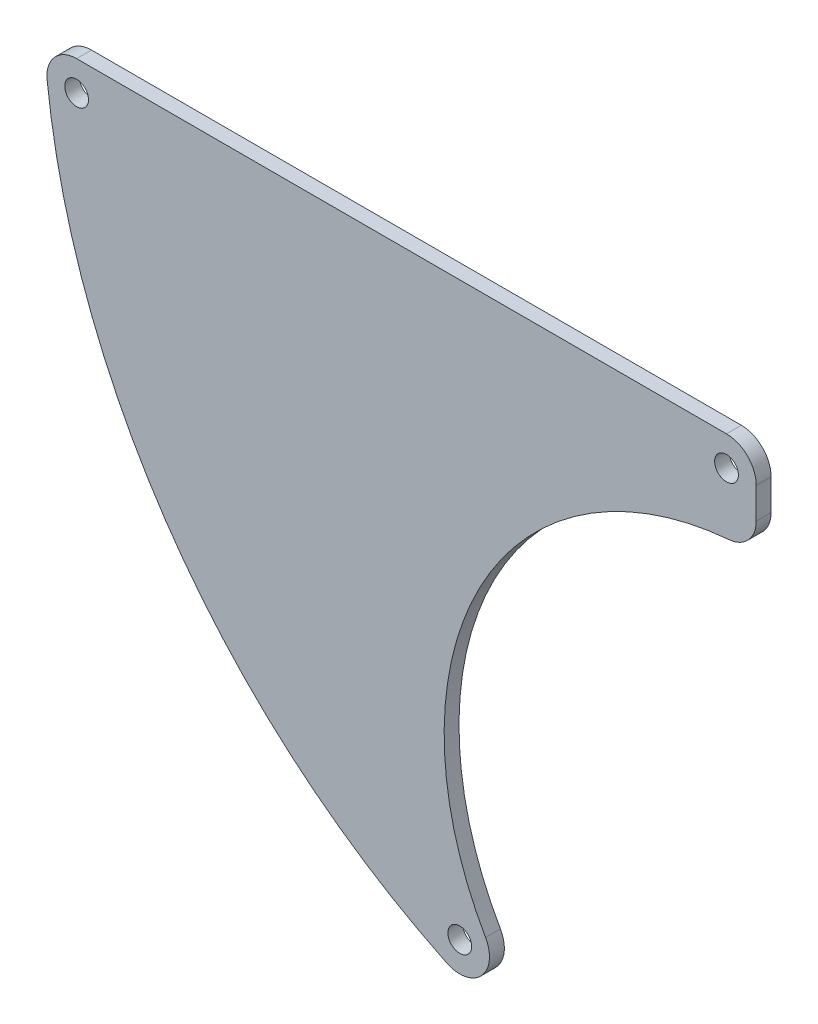
from build123d import *

# Parameters (mm, degrees)
SKETCH_1_R      = 0.8
EXTRUDE_1_DEPTH = 1


with BuildPart() as part:
    # Эскиз1 → Бобышка-Вытянуть1 (new body)
    with BuildSketch(Plane.XY):
        with BuildLine():
            Line((0, 40.912878475), (0, 43))
            ThreePointArc((0, 43), (-0.585786438, 44.414213562), (-2, 45))
            Line((-2, 45), (-45.727453461, 45))
            ThreePointArc((-45.727453461, 45), (-47.216544225, 44.335143699), (-47.715603611, 42.782608696))
            ThreePointArc((-47.715603611, 42.782608696), (-39.188772883, 20.282855848), (-20.814645128, 4.747826087))
            ThreePointArc((-20.814645128, 4.747826087), (-18.482786396, 5.188016153), (-18.212814487, 7.545652174))
            ThreePointArc((-18.212814487, 7.545652174), (-18.614079194, 27.721936832), (-1.826086957, 38.92045426))
            ThreePointArc((-1.826086957, 38.92045426), (-0.525580438, 39.561550625), (0, 40.912878475))
        make_face()
        with Locations((-19.947368247, 6.55)):
            Circle(SKETCH_1_R, mode=Mode.SUBTRACT)
        with Locations((-45.727453461, 43)):
            Circle(SKETCH_1_R, mode=Mode.SUBTRACT)
        with Locations((-2, 43)):
            Circle(SKETCH_1_R, mode=Mode.SUBTRACT)
    extrude(amount=EXTRUDE_1_DEPTH)


solid = part.part
